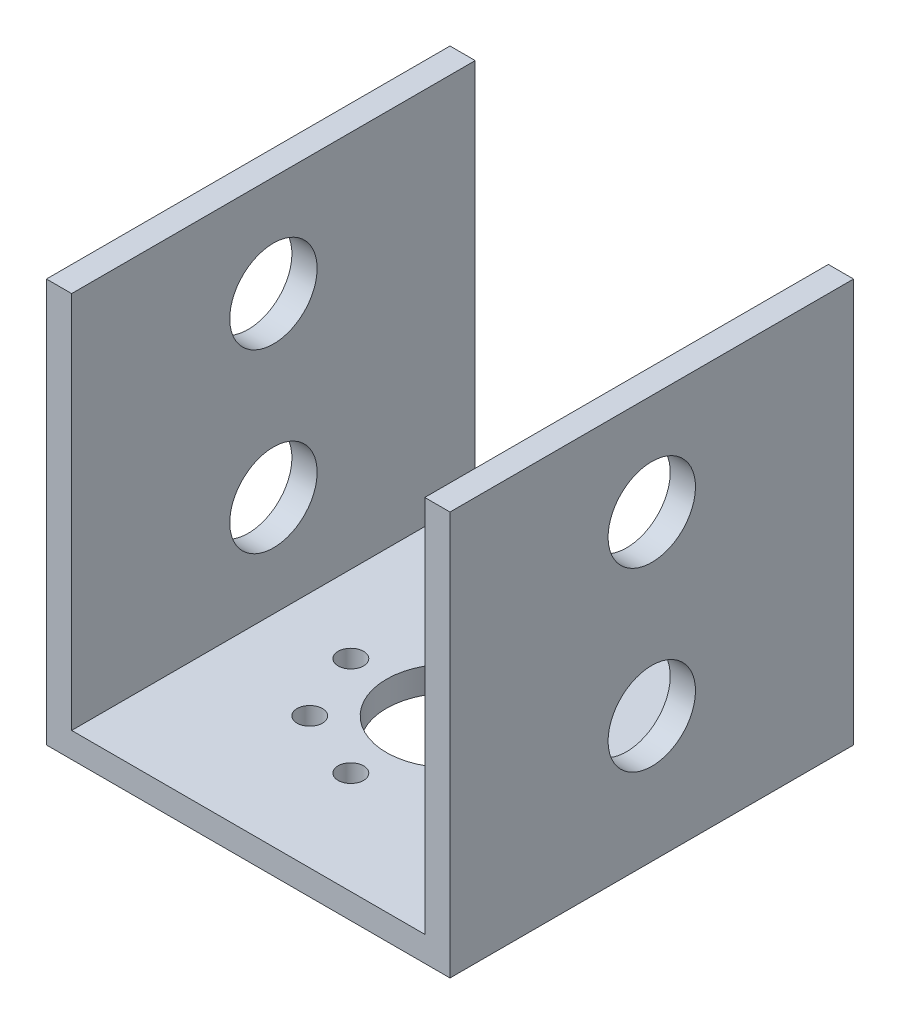
from build123d import *

# Parameters (mm, degrees)
BOSS_EXTRUDE1_DEPTH   = 25.4
SKETCH2_R             = 2.75
CUT_EXTRUDE1_DEPTH    = 44.097043475
SKETCH3_R             = 4
CUT_EXTRUDE2_DEPTH    = 38.060560658
M2X0_4_TAPPED_HOLE1_D = 1.6


with BuildPart() as part:
    # Sketch1 → Boss-Extrude1 (new body)
    with BuildSketch(Plane.XY):
        Polygon((-11.1125, 0), (11.1125, 0), (11.1125, 23.8125), (12.7, 23.8125), (12.7, -1.5875), (-12.7, -1.5875), (-12.7, 23.8125), (-11.1125, 23.8125), align=None)
    extrude(amount=BOSS_EXTRUDE1_DEPTH)

    # Sketch2 → Cut-Extrude1 (cut, through all)
    with BuildSketch(Plane(origin=(12.7, 0, 0), x_dir=(0, 0, -1), z_dir=(1, 0, 0))):
        with Locations(Location((-12.7, 17.4625, 0), (0, 0, 90))):
            Circle(SKETCH2_R)
        with Locations(Location((-12.7, 6.35, 0), (0, 0, 90))):
            Circle(SKETCH2_R)
    extrude(amount=-CUT_EXTRUDE1_DEPTH, mode=Mode.SUBTRACT)

    # Sketch3 → Cut-Extrude2 (cut, through all)
    with BuildSketch(Plane(origin=(0, 0, 0), x_dir=(1, 0, 0), z_dir=(0, 1, 0))):
        with Locations(Location((0, -12.7, 0), (0, 0, 180))):
            Circle(SKETCH3_R)
    extrude(amount=-CUT_EXTRUDE2_DEPTH, mode=Mode.SUBTRACT)

    # M2x0.4 Tapped Hole1 (through all)
    with Locations(Plane(origin=(0, 0, 0), x_dir=(1, 0, 0), z_dir=(0, 1, 0))):
        with Locations((0, -6.458326036), (4.413529986, -8.286470014), (6.241673964, -12.7), (4.413529986, -17.113529986), (0, -18.941673964), (-4.413529986, -17.113529986), (-6.241673964, -12.7), (-4.413529986, -8.286470014)):
            Hole(M2X0_4_TAPPED_HOLE1_D / 2)


solid = part.part
